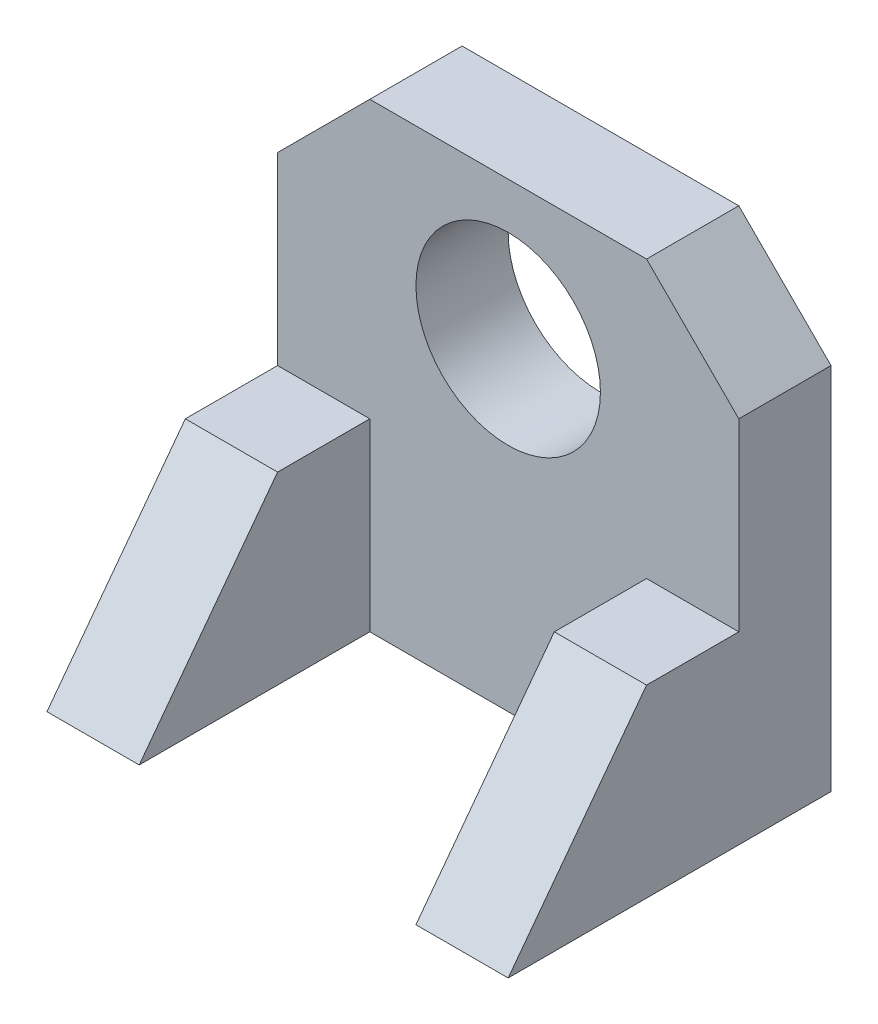
from build123d import *

# Parameters (mm, degrees)
SKETCH1_R           = 10
BOSS_EXTRUDE1_DEPTH = 10
BOSS_EXTRUDE2_START = 15
BOSS_EXTRUDE2_DEPTH = 10
BOSS_EXTRUDE3_START = -15
BOSS_EXTRUDE3_DEPTH = 10


with BuildPart() as part:
    # Sketch1 → Boss-Extrude1 (new body)
    with BuildSketch(Plane.XY):
        Polygon((-25, 0), (25, 0), (25, 40), (15, 50), (-15, 50), (-25, 40), align=None)
        with Locations((0, 35)):
            Circle(SKETCH1_R, mode=Mode.SUBTRACT)
    extrude(amount=BOSS_EXTRUDE1_DEPTH)

    # Sketch2 → Boss-Extrude2 (add)
    with BuildSketch(Plane(origin=(0, 0, 0), x_dir=(0, 0, -1), z_dir=(1, 0, 0)).offset(BOSS_EXTRUDE2_START)):
        Polygon((-10, 0), (-35, 0), (-20, 20), (-10, 20), (-10, 40), (0, 40), (0, 0), align=None)
    extrude(amount=BOSS_EXTRUDE2_DEPTH)

    # Sketch2<2> → Boss-Extrude3 (add)
    with BuildSketch(Plane(origin=(0, 0, 0), x_dir=(0, 0, -1), z_dir=(1, 0, 0)).offset(BOSS_EXTRUDE3_START)):
        Polygon((-35, 0), (-10, 0), (-10, 20), (-20, 20), align=None)
        Polygon((-10, 20), (-10, 0), (0, 0), (0, 40), (-10, 40), align=None)
    extrude(amount=-BOSS_EXTRUDE3_DEPTH)


solid = part.part
